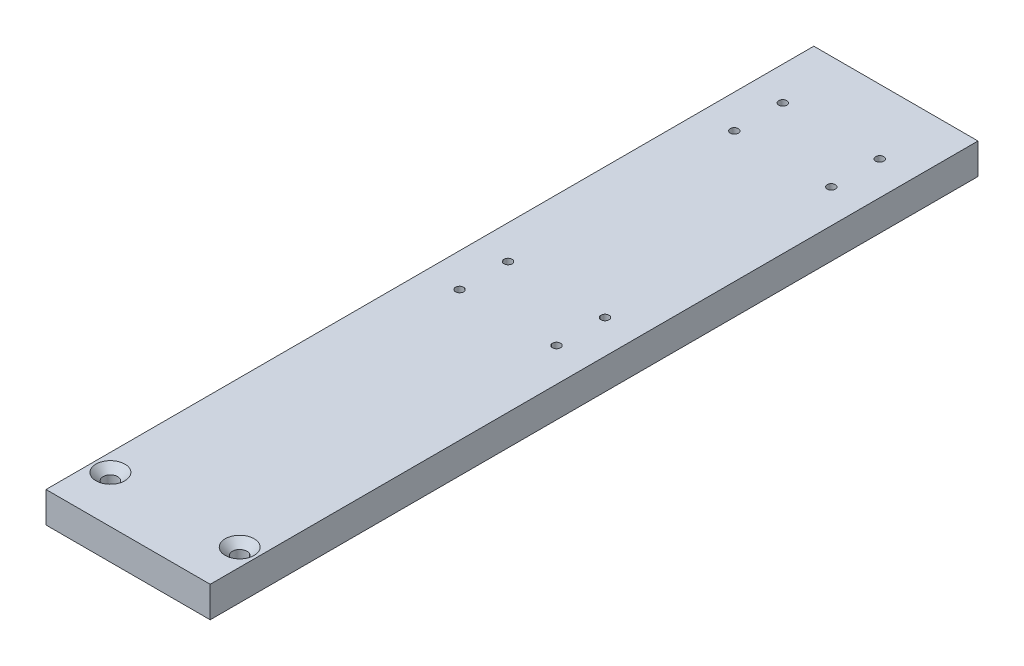
from build123d import *

# Parameters (mm, degrees)
SKETCH1_W                     = 50.8
SKETCH1_H                     = 9.525
BOSS_EXTRUDE1_DEPTH           = 118.775
TAP_DRILL_FOR_M3X0_5_TAP1_D   = 2.5
CSK_FOR_M4_SFHCS1_D           = 4.5
CSK_FOR_M4_SFHCS1_CSINK_D     = 8.96
CSK_FOR_M4_SFHCS1_CSINK_ANGLE = 90


with BuildPart() as part:
    # Sketch1 → Boss-Extrude1 (new, symmetric)
    with BuildSketch(Plane.XY):
        Rectangle(SKETCH1_W, SKETCH1_H)
    extrude(amount=BOSS_EXTRUDE1_DEPTH, both=True)

    # Tap Drill for M3x0.5 Tap1 (through all)
    with Locations(Plane(origin=(0, 4.7625, 0), x_dir=(1, 0, 0), z_dir=(0, 1, 0))):
        with Locations((-15, 98.775), (15, 98.775), (-15, 83.775), (15, 83.775), (15, 13.775), (-15, 13.775), (15, -1.225), (-15, -1.225)):
            Hole(TAP_DRILL_FOR_M3X0_5_TAP1_D / 2)

    # CSK for M4 SFHCS1 (through all)
    with Locations(Plane(origin=(0, 4.7625, 0), x_dir=(1, 0, 0), z_dir=(0, 1, 0))):
        with Locations((-20, -104.25), (20, -104.25)):
            CounterSinkHole(CSK_FOR_M4_SFHCS1_D / 2, CSK_FOR_M4_SFHCS1_CSINK_D / 2, counter_sink_angle=CSK_FOR_M4_SFHCS1_CSINK_ANGLE)


solid = part.part
